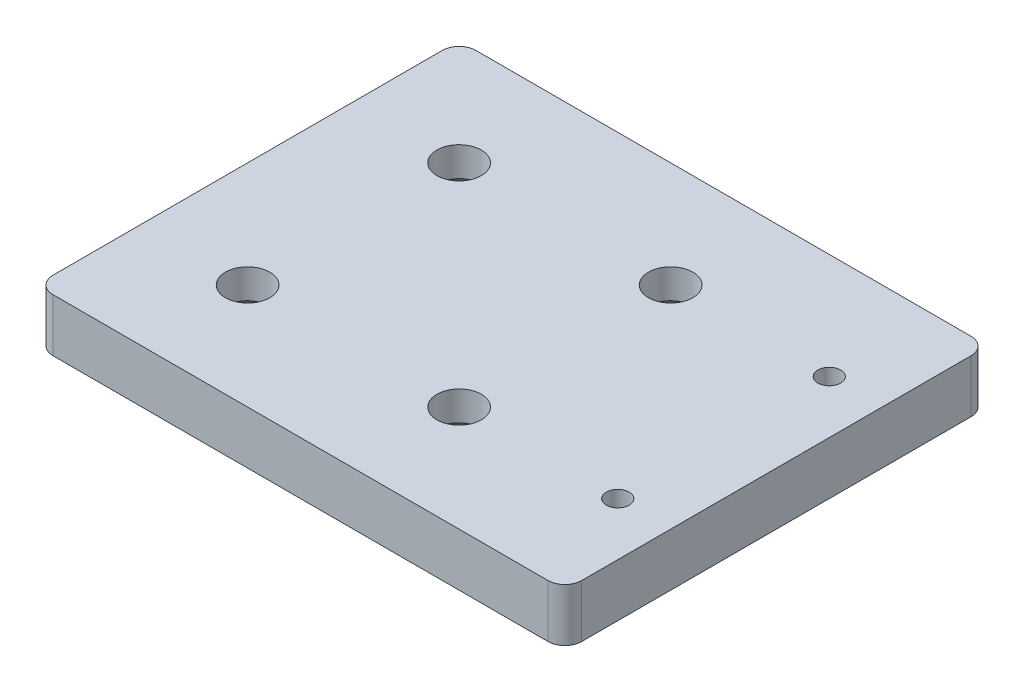
from build123d import *

# Parameters (mm, degrees)
BOSS_EXTRUDE1_DEPTH                             = 10
CSK_FOR_M8_FLAT_HEAD_MACHINE_SCREW1_D           = 8.4
CSK_FOR_M8_FLAT_HEAD_MACHINE_SCREW1_CSINK_D     = 17.3
CSK_FOR_M8_FLAT_HEAD_MACHINE_SCREW1_CSINK_ANGLE = 90
M4_CLEARANCE_HOLE1_D                            = 4.3


with BuildPart() as part:
    # Sketch1 → Boss-Extrude1 (new body)
    with BuildSketch(Plane(origin=(0, 0, 0), x_dir=(1, 0, 0), z_dir=(0, 1, 0))):
        with BuildLine():
            Line((-46.82, -40), (46.82, -40))
            ThreePointArc((46.82, -40), (49.068599564, -39.068599564), (50, -36.82))
            Line((50, -36.82), (50, 36.82))
            ThreePointArc((50, 36.82), (49.068599564, 39.068599564), (46.82, 40))
            Line((46.82, 40), (-46.82, 40))
            ThreePointArc((-46.82, 40), (-49.068599564, 39.068599564), (-50, 36.82))
            Line((-50, 36.82), (-50, -36.82))
            ThreePointArc((-50, -36.82), (-49.068599564, -39.068599564), (-46.82, -40))
        make_face()
    extrude(amount=BOSS_EXTRUDE1_DEPTH)

    # CSK for M8 Flat Head Machine Screw1 (through all)
    with Locations(Plane(origin=(0, 0, 0), x_dir=(-1, 0, 0), z_dir=(0, -1, 0))):
        with Locations((-10, 20), (30, 20), (30, -20), (-10, -20)):
            CounterSinkHole(CSK_FOR_M8_FLAT_HEAD_MACHINE_SCREW1_D / 2, CSK_FOR_M8_FLAT_HEAD_MACHINE_SCREW1_CSINK_D / 2, counter_sink_angle=CSK_FOR_M8_FLAT_HEAD_MACHINE_SCREW1_CSINK_ANGLE)

    # M4 Clearance Hole1 (through all)
    with Locations(Plane(origin=(0, 0, 0), x_dir=(-1, 0, 0), z_dir=(0, -1, 0))):
        with Locations((-40, 20), (-40, -20)):
            Hole(M4_CLEARANCE_HOLE1_D / 2)


solid = part.part
